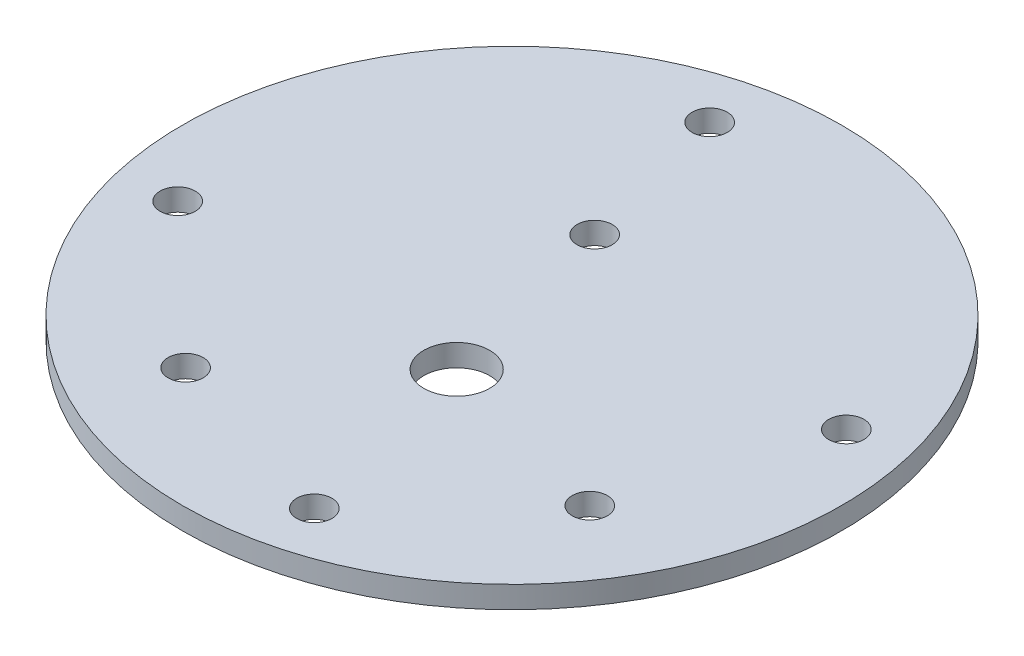
from build123d import *

# Parameters (mm, degrees)
SKETCH_1_R      = 30
SKETCH_1_R_2    = 3
SKETCH_1_R_3    = 1.6
EXTRUDE_1_DEPTH = 2


with BuildPart() as part:
    # 草图1 → 凸台-拉伸1 (new body)
    with BuildSketch(Plane(origin=(0, 0, 0), x_dir=(1, 0, 0), z_dir=(0, 1, 0))):
        with Locations(Location((-1.74081619, 6.776547835, 0), (0, 0, 270))):
            Circle(SKETCH_1_R)
        with Locations(Location((0, 0, 0), (0, 0, 270))):
            Circle(SKETCH_1_R_2, mode=Mode.SUBTRACT)
        with Locations(Location((-12.466036401, -12.21066896, 0), (0, 0, 270))):
            Circle(SKETCH_1_R_3, mode=Mode.SUBTRACT)
        with Locations(Location((-4.341731316, 16.901238688, 0), (0, 0, 270))):
            Circle(SKETCH_1_R_3, mode=Mode.SUBTRACT)
        with Locations(Location((16.807767717, -4.690569728, 0), (0, 0, 270))):
            Circle(SKETCH_1_R_3, mode=Mode.SUBTRACT)
        with Locations(Location((-7.960251519, 30.990564936, 0), (0, 0, 270))):
            Circle(SKETCH_1_R_3, mode=Mode.SUBTRACT)
        with Locations(Location((4.478619138, -17.437469267, 0), (0, 0, 270))):
            Circle(SKETCH_1_R_3, mode=Mode.SUBTRACT)
        with Locations(Location((22.473200911, 12.995983163, 0), (0, 0, 270))):
            Circle(SKETCH_1_R_3, mode=Mode.SUBTRACT)
        with Locations(Location((-25.954833292, 0.557112506, 0), (0, 0, 270))):
            Circle(SKETCH_1_R_3, mode=Mode.SUBTRACT)
    extrude(amount=EXTRUDE_1_DEPTH)


solid = part.part
